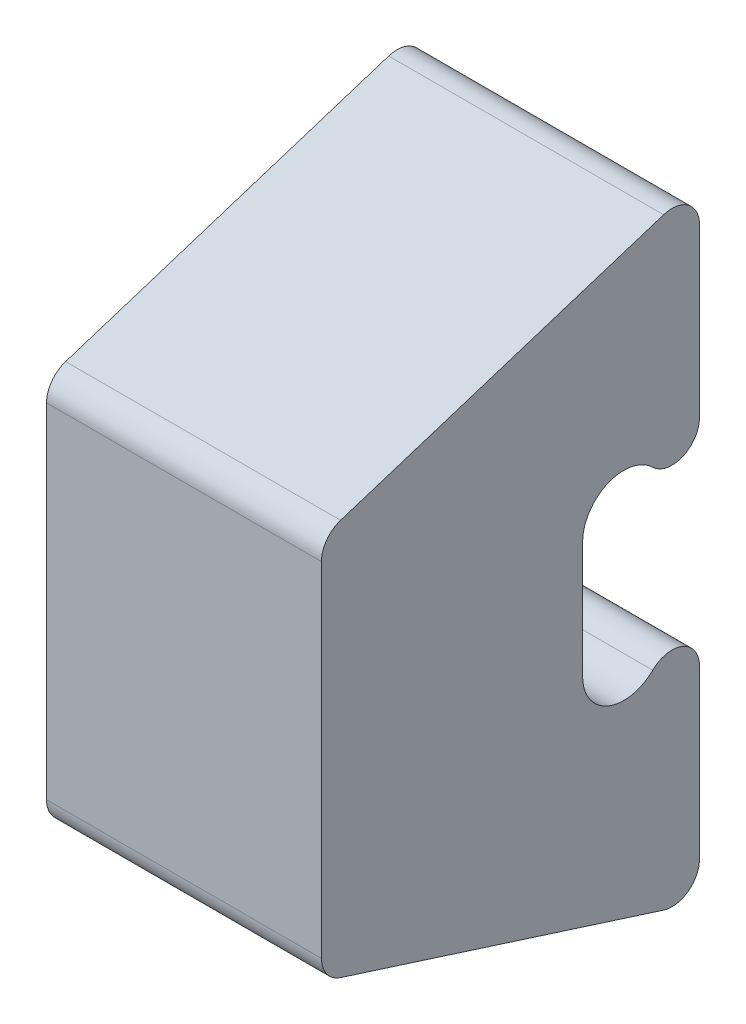
from build123d import *

# Parameters (mm, degrees)
BOSS_EXTRUDE1_DEPTH      = 1
BOSS_EXTRUDE1_DEPTH_BACK = 3


with BuildPart() as part:
    # Sketch3 → Boss-Extrude1 (new, two sides: drawn at the far end of the back side and taken through both)
    with BuildSketch(Plane.YZ.offset(-BOSS_EXTRUDE1_DEPTH_BACK)):
        with BuildLine():
            Line((-4, 5.4), (-1.56416825, 5.4))
            ThreePointArc((-1.56416825, 5.4), (-1.195386471, 5.645080666), (-1.278511113, 6.08))
            ThreePointArc((-1.278511113, 6.08), (-1.403198074, 6.732379001), (-0.850025407, 7.1))
            Line((-0.850025407, 7.1), (0.850025407, 7.1))
            ThreePointArc((0.850025407, 7.1), (1.403198074, 6.732379001), (1.278511113, 6.08))
            ThreePointArc((1.278511113, 6.08), (1.195386471, 5.645080666), (1.56416825, 5.4))
            Line((1.56416825, 5.4), (4, 5.4))
            ThreePointArc((4, 5.4), (4.322991043, 5.564040711), (4.381063684, 5.92161607))
            Line((4.381063684, 5.92161607), (2.881063684, 10.62161607))
            ThreePointArc((2.881063684, 10.62161607), (2.735959289, 10.822991043), (2.5, 10.9))
            Line((2.5, 10.9), (-2.5, 10.9))
            ThreePointArc((-2.5, 10.9), (-2.735959289, 10.822991043), (-2.881063684, 10.62161607))
            Line((-2.881063684, 10.62161607), (-4.381063684, 5.92161607))
            ThreePointArc((-4.381063684, 5.92161607), (-4.322991043, 5.564040711), (-4, 5.4))
        make_face()
    extrude(amount=BOSS_EXTRUDE1_DEPTH + BOSS_EXTRUDE1_DEPTH_BACK)


solid = part.part
